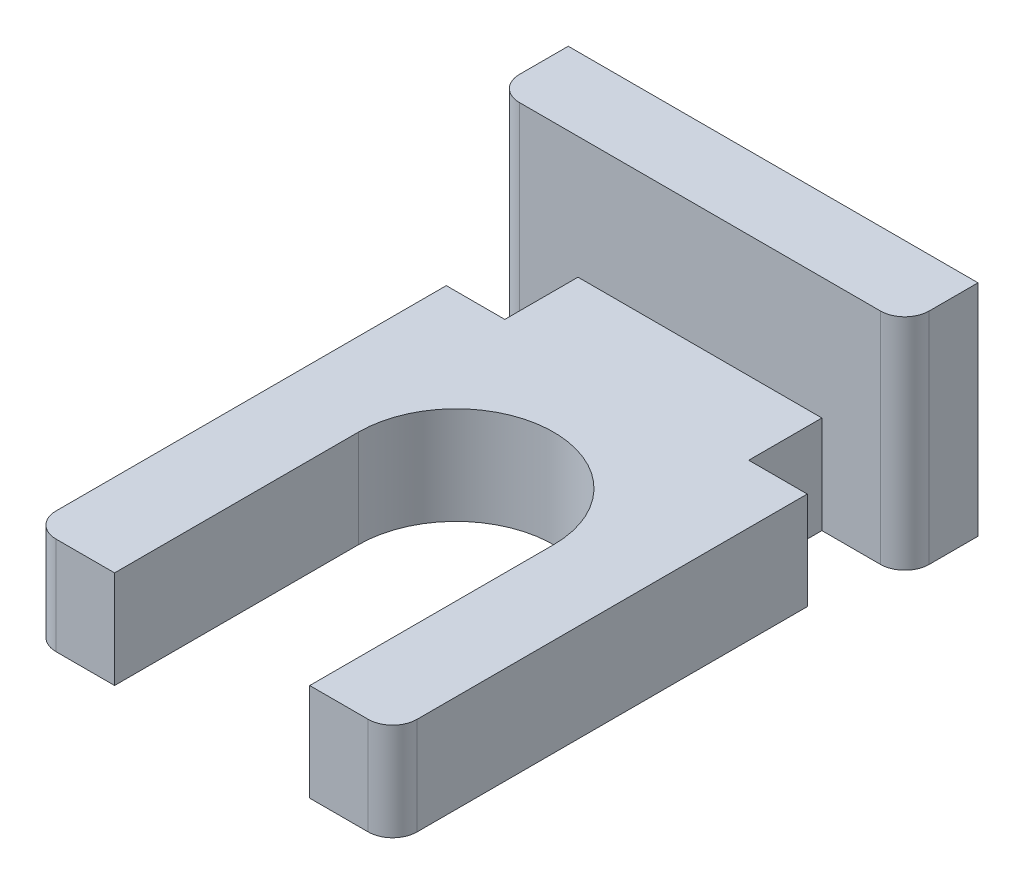
from build123d import *

# Parameters (mm, degrees)
ESQUISSE1_W        = 84
ESQUISSE1_H        = 45
BOSS_EXTRU_1_DEPTH = 15
BOSS_EXTRU_2_DEPTH = 20
CONG_1_R           = 5


with BuildPart() as part:
    # Esquisse1 → Boss.-Extru.1 (new body)
    with BuildSketch(Plane.XY):
        Rectangle(ESQUISSE1_W, ESQUISSE1_H)
    extrude(amount=BOSS_EXTRU_1_DEPTH)

    # Esquisse2 → Boss.-Extru.2 (add)
    with BuildSketch(Plane.XZ.offset(22.5)):
        with BuildLine():
            Line((37, 115), (37, 30))
            Line((37, 30), (25, 30))
            Line((25, 30), (25, 15))
            Line((25, 15), (0, 15))
            Line((0, 15), (-25, 15))
            Line((-25, 15), (-25, 30))
            Line((-25, 30), (-37, 30))
            Line((-37, 30), (-37, 115))
            Line((-37, 115), (-20, 115))
            Line((-20, 115), (-20, 65))
            ThreePointArc((-20, 65), (0, 45), (20, 65))
            Line((20, 65), (20, 115))
            Line((20, 115), (37, 115))
        make_face()
    extrude(amount=-BOSS_EXTRU_2_DEPTH)

    # Congé1
    cong_1_edges = [part.edges().sort_by_distance(p)[0] for p in [
        (42, 0, 15),
        (37, -12.5, 115),
        (-37, -12.5, 115),
        (-42, 0, 15),
    ]]
    fillet(cong_1_edges, radius=CONG_1_R)


solid = part.part
